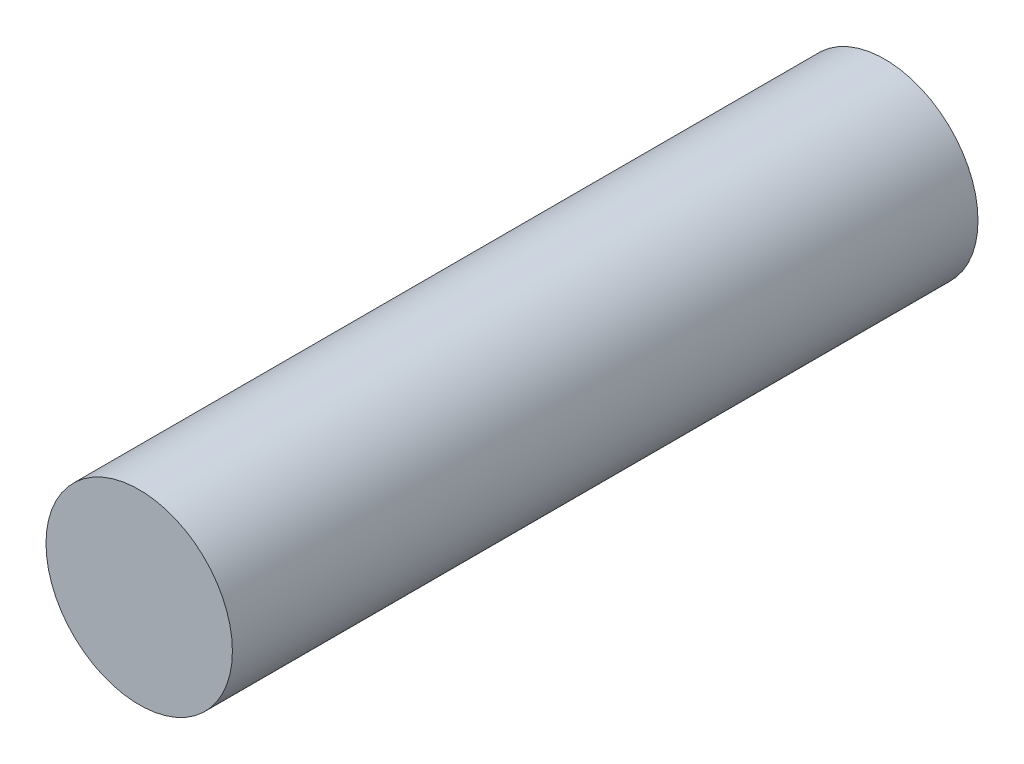
from build123d import *

# Parameters (mm, degrees)
SKETCH1_R           = 4.7625
BOSS_EXTRUDE1_DEPTH = 19.05


with BuildPart() as part:
    # Sketch1 → Boss-Extrude1 (new, symmetric)
    with BuildSketch(Plane.XY):
        with Locations(Location((0, 0, 0), (0, 0, 180))):
            Circle(SKETCH1_R)
    extrude(amount=BOSS_EXTRUDE1_DEPTH, both=True)


solid = part.part
